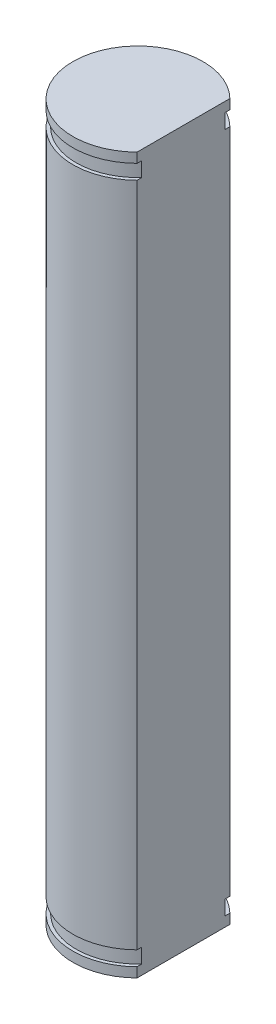
from build123d import *

# Parameters (mm, degrees)
CUT_EXTRUDE1_DEPTH = 45.362146026


with BuildPart() as part:
    # Sketch1 → Revolve1 (revolve)
    with BuildSketch(Plane.XY, mode=Mode.PRIVATE) as revolve1_sk:
        Polygon((0, 0), (-4, 0), (-4, -0.6), (-3.8, -0.6), (-3.8, -1.5), (-4, -1.5), (-4, -42.5), (-3.8, -42.5), (-3.8, -43.4), (-4, -43.4), (-4, -44), (0, -44), align=None)
    revolve(revolve1_sk.sketch.rotate(Axis((0, -44, 0), (0, 1, 0)), 270), axis=Axis((0, -44, 0), (0, 1, 0)))

    # Sketch2 → Cut-Extrude1 (cut, through all)
    with BuildSketch(Plane(origin=(0, 0, 0), x_dir=(1, 0, 0), z_dir=(0, 1, 0))):
        with BuildLine():
            Line((2.8, -2.856571371), (2.8, 2.856571371))
            ThreePointArc((2.8, 2.856571371), (4, 0), (2.8, -2.856571371))
        make_face()
    extrude(amount=-CUT_EXTRUDE1_DEPTH, mode=Mode.SUBTRACT)


solid = part.part
